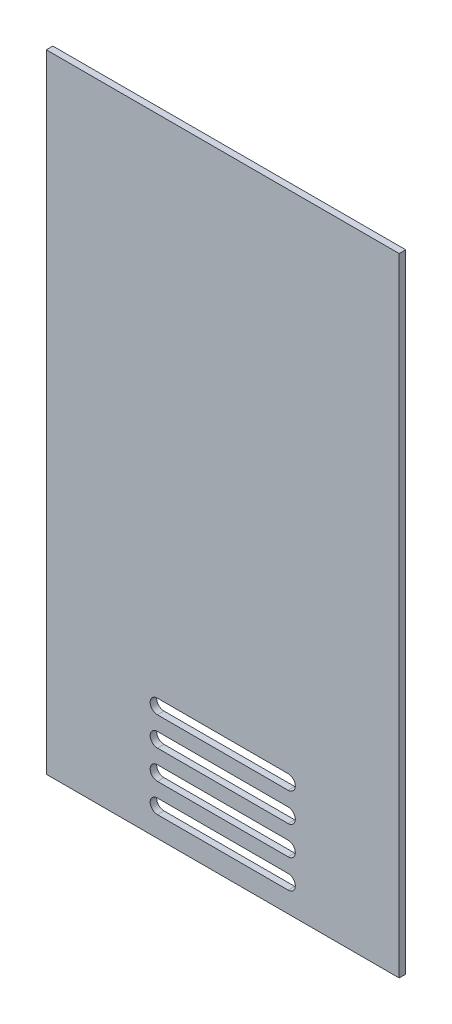
from build123d import *

# Parameters (mm, degrees)
SKETCH1_W           = 171.45
SKETCH1_H           = 304.8
BOSS_EXTRUDE1_DEPTH = 3.175
CUT_EXTRUDE1_DEPTH  = 3.175


with BuildPart() as part:
    # Sketch1 → Boss-Extrude1 (new body)
    with BuildSketch(Plane.XY):
        with Locations((-27.711706949, -64.603096677)):
            Rectangle(SKETCH1_W, SKETCH1_H)
    extrude(amount=BOSS_EXTRUDE1_DEPTH)

    # Sketch2 → Cut-Extrude1 (cut)
    with BuildSketch(Plane.XY.offset(3.175)):
        with BuildLine():
            Line((-59.461706949, -200.003096677), (4.038293051, -200.003096677))
            ThreePointArc((4.038293051, -200.003096677), (7.538293051, -203.503096677), (4.038293051, -207.003096677))
            Line((4.038293051, -207.003096677), (-59.461706949, -207.003096677))
            ThreePointArc((-59.461706949, -207.003096677), (-62.961706949, -203.503096677), (-59.461706949, -200.003096677))
        make_face()
        with BuildLine():
            Line((-59.461706949, -186.003096677), (4.038293051, -186.003096677))
            ThreePointArc((4.038293051, -186.003096677), (7.538293051, -189.503096677), (4.038293051, -193.003096677))
            Line((4.038293051, -193.003096677), (-59.461706949, -193.003096677))
            ThreePointArc((-59.461706949, -193.003096677), (-62.961706949, -189.503096677), (-59.461706949, -186.003096677))
        make_face()
        with BuildLine():
            Line((-59.461706949, -172.003096677), (4.038293051, -172.003096677))
            ThreePointArc((4.038293051, -172.003096677), (7.538293051, -175.503096677), (4.038293051, -179.003096677))
            Line((4.038293051, -179.003096677), (-59.461706949, -179.003096677))
            ThreePointArc((-59.461706949, -179.003096677), (-62.961706949, -175.503096677), (-59.461706949, -172.003096677))
        make_face()
        with BuildLine():
            Line((-59.461706949, -158.003096677), (4.038293051, -158.003096677))
            ThreePointArc((4.038293051, -158.003096677), (7.538293051, -161.503096677), (4.038293051, -165.003096677))
            Line((4.038293051, -165.003096677), (-59.461706949, -165.003096677))
            ThreePointArc((-59.461706949, -165.003096677), (-62.961706949, -161.503096677), (-59.461706949, -158.003096677))
        make_face()
    extrude(amount=-CUT_EXTRUDE1_DEPTH, mode=Mode.SUBTRACT)


solid = part.part
